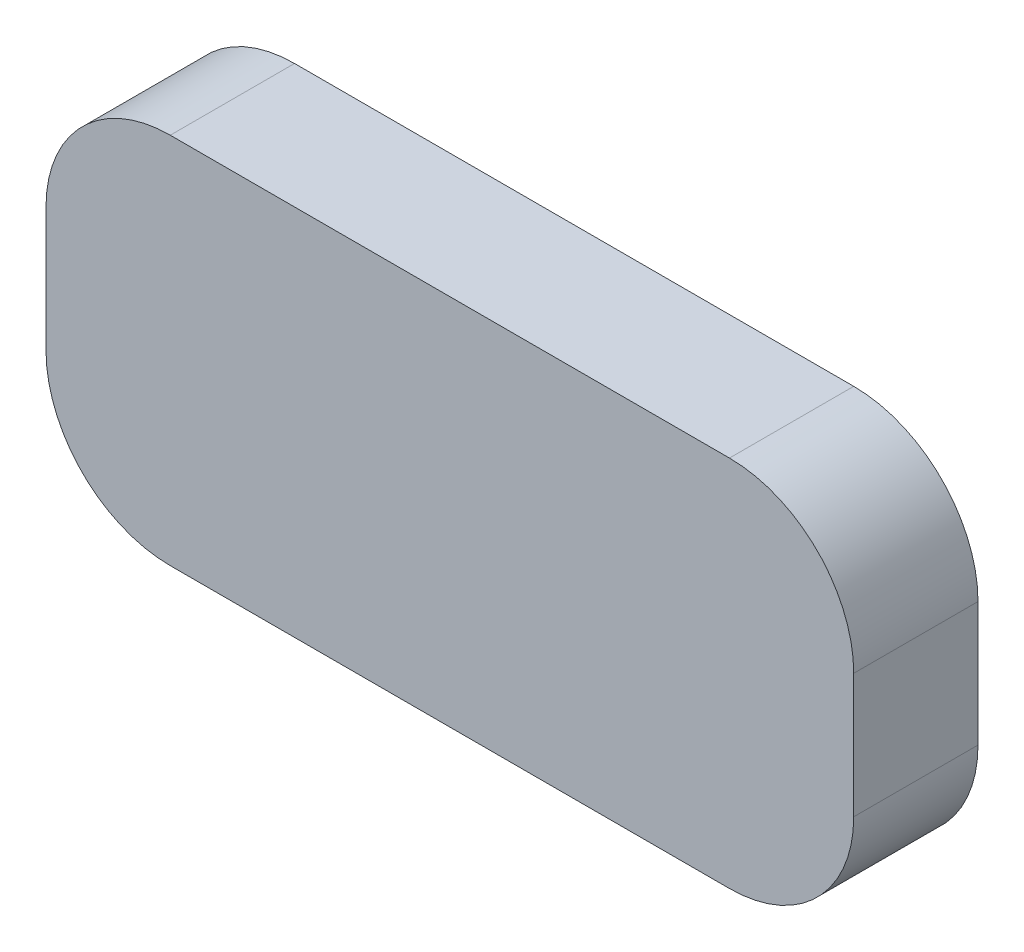
from build123d import *

# Parameters (mm, degrees)
EXTRUDE_4_DEPTH = 10


with BuildPart() as part:
    # 草图1 → 凸台-拉伸4 (new body)
    with BuildSketch(Plane.XY):
        with BuildLine():
            Line((-36.878713353, 8.734454628), (8.121286647, 8.734454628))
            ThreePointArc((8.121286647, 8.734454628), (15.192354459, 5.80552244), (18.121286647, -1.265545372))
            Line((18.121286647, -1.265545372), (18.121286647, -11.265545372))
            ThreePointArc((18.121286647, -11.265545372), (15.192354459, -18.336613184), (8.121286647, -21.265545372))
            Line((8.121286647, -21.265545372), (-36.878713353, -21.265545372))
            ThreePointArc((-36.878713353, -21.265545372), (-43.949781165, -18.336613184), (-46.878713353, -11.265545372))
            Line((-46.878713353, -11.265545372), (-46.878713353, -1.265545372))
            ThreePointArc((-46.878713353, -1.265545372), (-43.949781165, 5.80552244), (-36.878713353, 8.734454628))
        make_face()
    extrude(amount=EXTRUDE_4_DEPTH)


solid = part.part
